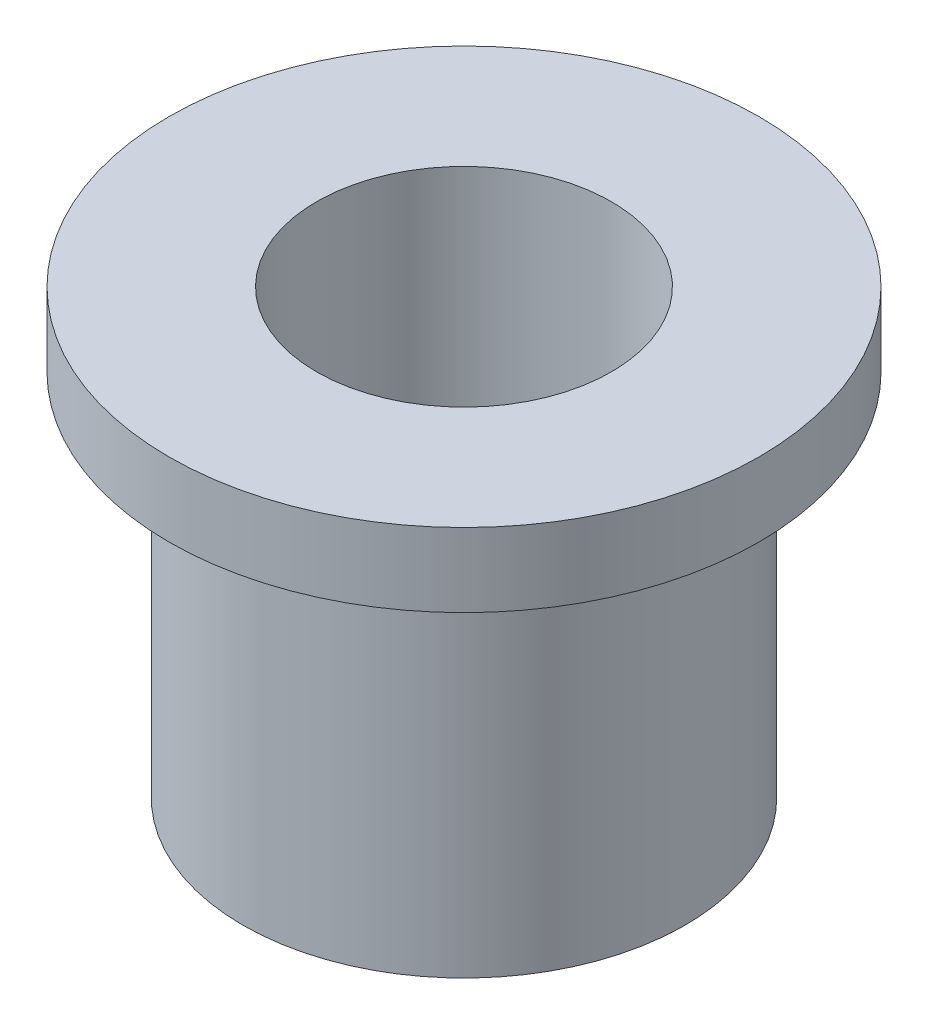
from build123d import *


with BuildPart() as part:
    # Sketch1 → Revolve1 (revolve)
    with BuildSketch(Plane.XY, mode=Mode.PRIVATE) as revolve1_sk:
        Polygon((3.175, 0), (3.175, -9.525), (4.7625, -9.525), (4.7625, -1.5875), (6.35, -1.5875), (6.35, 0), align=None)
    revolve(revolve1_sk.sketch.rotate(Axis((0, 0, 0), (0, -1, 0)), 90), axis=Axis((0, 0, 0), (0, -1, 0)))


solid = part.part
